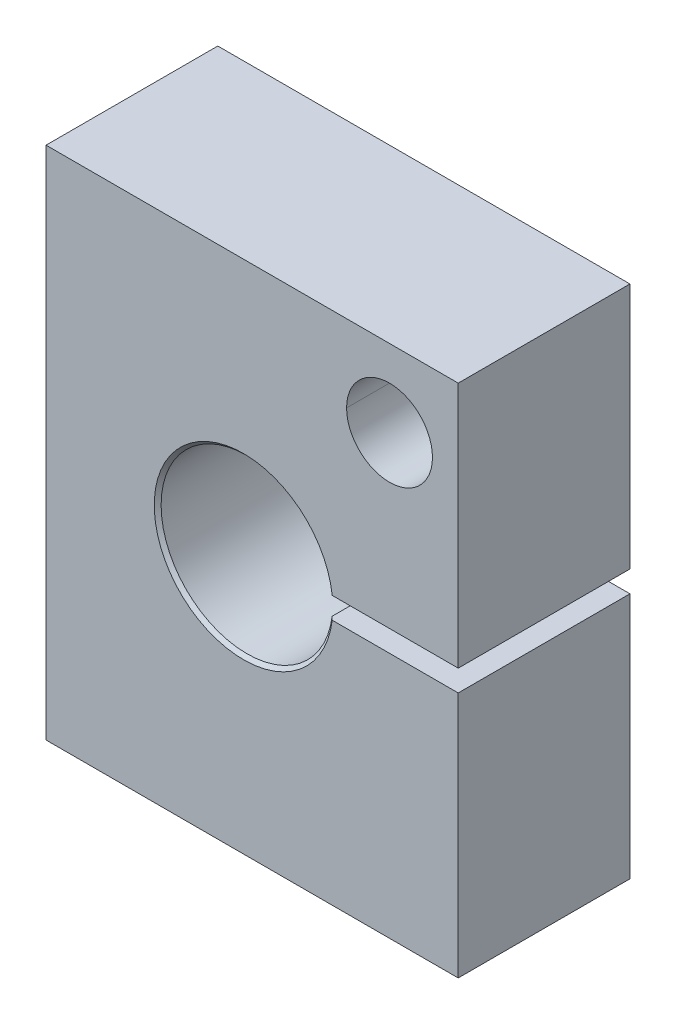
from build123d import *

# Parameters (mm, degrees)
SKETCH1_W           = 30.48
SKETCH1_H           = 38.1
BOSS_EXTRUDE1_DEPTH = 6.35
CUT_EXTRUDE2_DEPTH  = 28.503637941
CHAMFER1_SIZE       = 0.254
SKETCH8_R           = 3.175
CUT_EXTRUDE4_DEPTH  = 28.503637941


with BuildPart() as part:
    # Sketch1 → Boss-Extrude1 (new, symmetric)
    with BuildSketch(Plane.XY):
        Rectangle(SKETCH1_W, SKETCH1_H)
    extrude(amount=BOSS_EXTRUDE1_DEPTH, both=True)

    # Sketch2 → Cut-Extrude2 (cut, through all)
    with BuildSketch(Plane.XY.offset(6.35)):
        with BuildLine():
            Line((97.980767498, 0.79375), (15.24, 0.79375))
            Line((15.24, 0.79375), (5.665195309, 0.79375))
            ThreePointArc((5.665195309, 0.79375), (-6.985, 0), (5.665195309, -0.79375))
            Line((5.665195309, -0.79375), (15.24, -0.79375))
            Line((15.24, -0.79375), (97.980767498, -0.79375))
            Line((97.980767498, -0.79375), (263.462302495, -0.79375))
            Line((263.462302495, -0.79375), (263.462302495, 0.79375))
            Line((263.462302495, 0.79375), (97.980767498, 0.79375))
        make_face()
    extrude(amount=-CUT_EXTRUDE2_DEPTH, mode=Mode.SUBTRACT)

    # Sketch6 → 1/4 (0.25) Diameter Hole1 (revolve, cut)
    with BuildSketch(Plane(origin=(8.89, -19.05, 0), x_dir=(0, 0, -1), z_dir=(1, 0, 0))):
        Polygon((0, 0), (0, 9.527732465), (3.175, 7.62), (3.175, 0), align=None)
    f_1_4_0_25_diameter_hole1 = revolve(axis=Axis((8.89, -25.4, 0), (0, 1, 0)), mode=Mode.SUBTRACT)

    # Chamfer1
    chamfer1_edges = [part.edges().sort_by_distance(p)[0] for p in [
        (-6.985, 0, -6.35),
        (-6.985, 0, 6.35),
    ]]
    chamfer(chamfer1_edges, length=CHAMFER1_SIZE)

    # Mirror1: 1/4 (0.25) Diameter Hole1 across plane
    add(f_1_4_0_25_diameter_hole1.mirror(Plane(origin=(0, 0, 0), x_dir=(0, 0, 1), z_dir=(1, 0, 0))), mode=Mode.SUBTRACT)

    # Sketch8 → Cut-Extrude4 (cut, through all)
    with BuildSketch(Plane.XY.offset(6.35)):
        with Locations((10.16, 13.335)):
            Circle(SKETCH8_R)
    extrude(amount=-CUT_EXTRUDE4_DEPTH, mode=Mode.SUBTRACT)


solid = part.part
